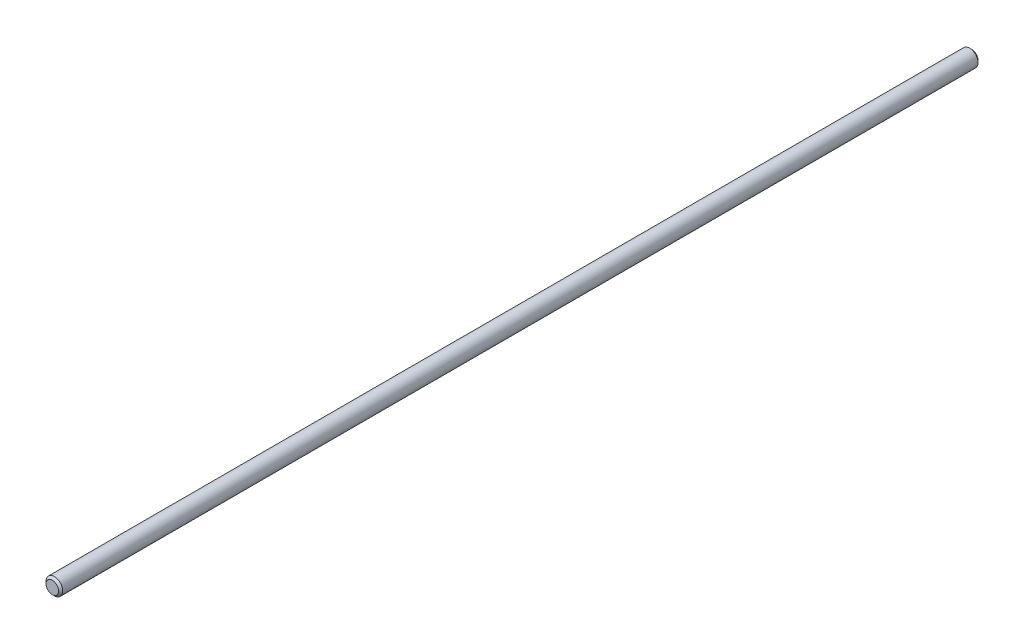
from build123d import *

# Parameters (mm, degrees)
SKETCH1_R           = 4
BOSS_EXTRUDE1_DEPTH = 440
CHAMFER1_SIZE       = 1


with BuildPart() as part:
    # Sketch1 → Boss-Extrude1 (new body)
    with BuildSketch(Plane.XY):
        Circle(SKETCH1_R)
    extrude(amount=BOSS_EXTRUDE1_DEPTH)

    # Chamfer1
    chamfer1_edges = [part.edges().sort_by_distance(p)[0] for p in [
        (-4, 0, 0),
        (-4, 0, 440),
    ]]
    chamfer(chamfer1_edges, length=CHAMFER1_SIZE)


solid = part.part
